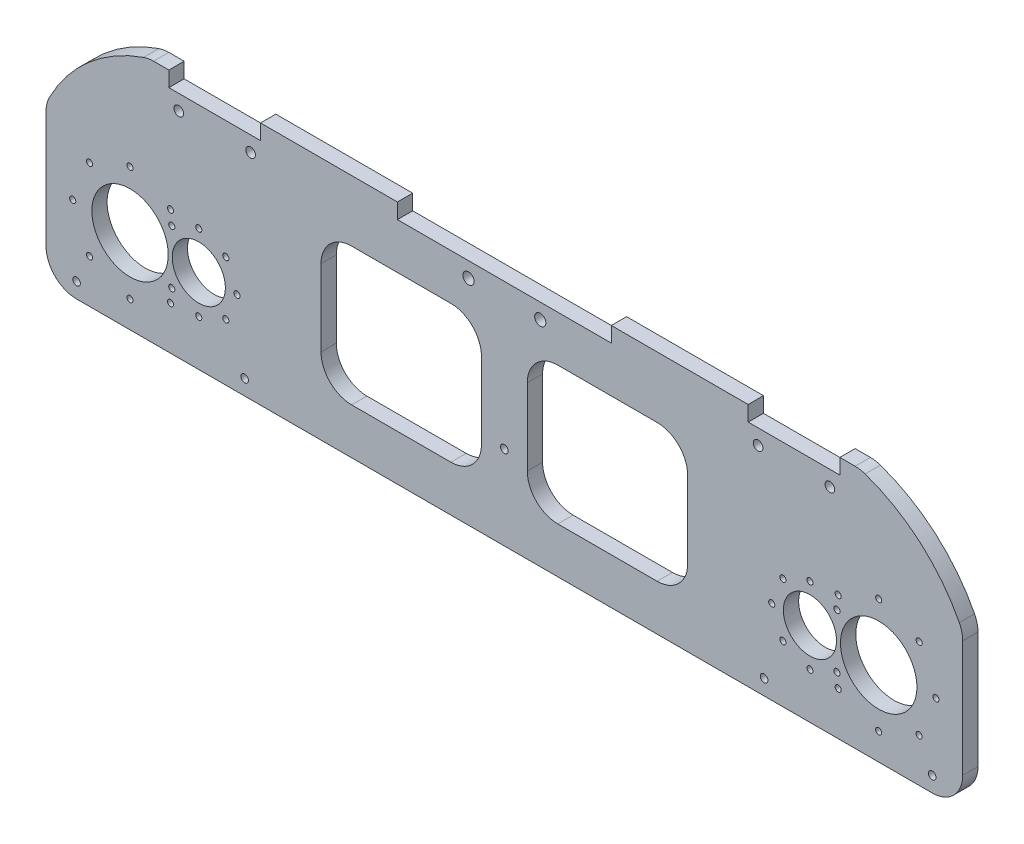
from build123d import *

# Parameters (mm, degrees)
SKETCH1_R           = 3.175
BOSS_EXTRUDE1_DEPTH = 3.175
SKETCH2_R           = 11.049
SKETCH2_R_2         = 15.875
SKETCH2_R_3         = 1.27
CUT_EXTRUDE1_DEPTH  = 202.930998425
SKETCH3_W           = 38.1
SKETCH3_H           = 6.35
SKETCH3_W_2         = 88.9
CUT_EXTRUDE4_DEPTH  = 202.930998425
CUT_EXTRUDE5_DEPTH  = 202.930998425
SKETCH5_R           = 2.003539073
SKETCH5_R_2         = 2.332520908
CUT_EXTRUDE6_DEPTH  = 202.930998425
SKETCH6_R           = 1.5875
CUT_EXTRUDE7_DEPTH  = 202.930998425
SKETCH7_R           = 1.5875
CUT_EXTRUDE8_DEPTH  = 202.930998425


with BuildPart() as part:
    # Sketch1 → Boss-Extrude1 (new, symmetric)
    with BuildSketch(Plane.XY):
        with BuildLine():
            Line((-145.783553311, 66.675), (145.783553311, 66.675))
            ThreePointArc((145.783553311, 66.675), (147.900219978, 66.497368874), (149.957676269, 65.969444444))
            ThreePointArc((149.957676269, 65.969444444), (172.789871953, 52.74760778), (189.088888889, 31.999880883))
            ThreePointArc((189.088888889, 31.999880883), (190.142181511, 29.17513943), (190.5, 26.181720723))
            Line((190.5, 26.181720723), (190.5, -22.225))
            ThreePointArc((190.5, -22.225), (186.780256121, -31.205256121), (177.8, -34.925))
            Line((177.8, -34.925), (-177.8, -34.925))
            ThreePointArc((-177.8, -34.925), (-186.780256121, -31.205256121), (-190.5, -22.225))
            Line((-190.5, -22.225), (-190.5, 26.181720723))
            ThreePointArc((-190.5, 26.181720723), (-190.142181511, 29.17513943), (-189.088888889, 31.999880883))
            ThreePointArc((-189.088888889, 31.999880883), (-172.789871953, 52.74760778), (-149.957676269, 65.969444444))
            ThreePointArc((-149.957676269, 65.969444444), (-147.900219978, 66.497368874), (-145.783553311, 66.675))
        make_face()
        with Locations((-127, 0)):
            Circle(SKETCH1_R, mode=Mode.SUBTRACT)
        with Locations((127, 0)):
            Circle(SKETCH1_R, mode=Mode.SUBTRACT)
    extrude(amount=BOSS_EXTRUDE1_DEPTH, both=True)

    # Sketch2 → Cut-Extrude1 (cut, through all)
    with BuildSketch(Plane.XY.offset(3.175)):
        with Locations((-127, 0)):
            Circle(SKETCH2_R)
        with Locations((-155.575, 0)):
            Circle(SKETCH2_R_2)
        with Locations((-155.575, 23.8125)):
            Circle(SKETCH2_R_3)
        with Locations((-138.737019773, 16.837980227)):
            Circle(SKETCH2_R_3)
        with Locations((-138.737019773, -16.837980227)):
            Circle(SKETCH2_R_3)
        with Locations((-155.575, -23.8125)):
            Circle(SKETCH2_R_3)
        with Locations((-172.412980227, -16.837980227)):
            Circle(SKETCH2_R_3)
        with Locations((-179.3875, 0)):
            Circle(SKETCH2_R_3)
        with Locations((-172.412980227, 16.837980227)):
            Circle(SKETCH2_R_3)
        with Locations((-127, 15.875)):
            Circle(SKETCH2_R_3)
        with Locations((-115.774679849, 11.225320151)):
            Circle(SKETCH2_R_3)
        with Locations((-111.125, 0)):
            Circle(SKETCH2_R_3)
        with Locations((-115.774679849, -11.225320151)):
            Circle(SKETCH2_R_3)
        with Locations((-127, -15.875)):
            Circle(SKETCH2_R_3)
        with Locations((-138.225320151, -11.225320151)):
            Circle(SKETCH2_R_3)
        with Locations(Location((138.225320151, 11.225320151, 0), (0, 0, 180))):
            Circle(SKETCH2_R_3)
        with Locations((-138.225320151, 11.225320151)):
            Circle(SKETCH2_R_3)
        with Locations(Location((138.225320151, -11.225320151, 0), (0, 0, 180))):
            Circle(SKETCH2_R_3)
        with Locations(Location((127, -15.875, 0), (0, 0, 180))):
            Circle(SKETCH2_R_3)
        with Locations(Location((115.774679849, -11.225320151, 0), (0, 0, 180))):
            Circle(SKETCH2_R_3)
        with Locations(Location((111.125, 0, 0), (0, 0, 180))):
            Circle(SKETCH2_R_3)
        with Locations(Location((115.774679849, 11.225320151, 0), (0, 0, 180))):
            Circle(SKETCH2_R_3)
        with Locations(Location((127, 15.875, 0), (0, 0, 180))):
            Circle(SKETCH2_R_3)
        with Locations(Location((172.412980227, 16.837980227, 0), (0, 0, 180))):
            Circle(SKETCH2_R_3)
        with Locations(Location((179.3875, 0, 0), (0, 0, 180))):
            Circle(SKETCH2_R_3)
        with Locations(Location((172.412980227, -16.837980227, 0), (0, 0, 180))):
            Circle(SKETCH2_R_3)
        with Locations(Location((155.575, -23.8125, 0), (0, 0, 180))):
            Circle(SKETCH2_R_3)
        with Locations(Location((138.737019773, -16.837980227, 0), (0, 0, 180))):
            Circle(SKETCH2_R_3)
        with Locations(Location((138.737019773, 16.837980227, 0), (0, 0, 180))):
            Circle(SKETCH2_R_3)
        with Locations(Location((155.575, 23.8125, 0), (0, 0, 180))):
            Circle(SKETCH2_R_3)
        with Locations(Location((155.575, 0, 0), (0, 0, 180))):
            Circle(SKETCH2_R_2)
        with Locations(Location((127, 0, 0), (0, 0, 180))):
            Circle(SKETCH2_R)
    extrude(amount=-CUT_EXTRUDE1_DEPTH, mode=Mode.SUBTRACT)

    # Sketch3 → Cut-Extrude4 (cut, through all)
    with BuildSketch(Plane.XY.offset(3.175)):
        with Locations((-120.383553311, 63.5)):
            Rectangle(SKETCH3_W, SKETCH3_H)
        with Locations((120.383553311, 63.5)):
            Rectangle(SKETCH3_W, SKETCH3_H)
        with Locations((0, 63.5)):
            Rectangle(SKETCH3_W_2, SKETCH3_H)
    extrude(amount=-CUT_EXTRUDE4_DEPTH, mode=Mode.SUBTRACT)

    # Sketch4 → Cut-Extrude5 (cut, through all)
    with BuildSketch(Plane.XY.offset(3.175)):
        with BuildLine():
            Line((-63.5, 41.275), (-22.225, 41.275))
            ThreePointArc((-22.225, 41.275), (-13.244743879, 37.555256121), (-9.525, 28.575))
            Line((-9.525, 28.575), (-9.525, -3.175))
            ThreePointArc((-9.525, -3.175), (-13.244743879, -12.155256121), (-22.225, -15.875))
            Line((-22.225, -15.875), (-63.5, -15.875))
            ThreePointArc((-63.5, -15.875), (-72.480256121, -12.155256121), (-76.2, -3.175))
            Line((-76.2, -3.175), (-76.2, 28.575))
            ThreePointArc((-76.2, 28.575), (-72.480256121, 37.555256121), (-63.5, 41.275))
        make_face()
        with BuildLine():
            Line((76.2, 28.575), (76.2, -3.175))
            ThreePointArc((76.2, -3.175), (72.480256121, -12.155256121), (63.5, -15.875))
            Line((63.5, -15.875), (22.225, -15.875))
            ThreePointArc((22.225, -15.875), (13.244743879, -12.155256121), (9.525, -3.175))
            Line((9.525, -3.175), (9.525, 28.575))
            ThreePointArc((9.525, 28.575), (13.244743879, 37.555256121), (22.225, 41.275))
            Line((22.225, 41.275), (63.5, 41.275))
            ThreePointArc((63.5, 41.275), (72.480256121, 37.555256121), (76.2, 28.575))
        make_face()
    extrude(amount=-CUT_EXTRUDE5_DEPTH, mode=Mode.SUBTRACT)

    # Sketch5 → Cut-Extrude6 (cut, through all)
    with BuildSketch(Plane.XY.offset(3.175)):
        with Locations((-135.306053311, 53.975)):
            Circle(SKETCH5_R)
        with Locations(Location((-105.461053311, 53.975, 0), (0, 0, 180))):
            Circle(SKETCH5_R)
        with Locations((105.461053311, 53.975)):
            Circle(SKETCH5_R)
        with Locations(Location((135.306053311, 53.975, 0), (0, 0, 180))):
            Circle(SKETCH5_R)
        with Locations((-14.9225, 53.975)):
            Circle(SKETCH5_R_2)
        with Locations(Location((14.9225, 53.975, 0), (0, 0, 180))):
            Circle(SKETCH5_R_2)
    extrude(amount=-CUT_EXTRUDE6_DEPTH, mode=Mode.SUBTRACT)

    # Sketch6 → Cut-Extrude7 (cut, through all)
    with BuildSketch(Plane.XY.offset(3.175)):
        with Locations((-177.8, -28.575)):
            Circle(SKETCH6_R)
        with Locations((-107.95, -28.575)):
            Circle(SKETCH6_R)
        with Locations(Location((107.95, -28.575, 0), (0, 0, 180))):
            Circle(SKETCH6_R)
        with Locations(Location((177.8, -28.575, 0), (0, 0, 180))):
            Circle(SKETCH6_R)
    extrude(amount=-CUT_EXTRUDE7_DEPTH, mode=Mode.SUBTRACT)

    # Sketch7 → Cut-Extrude8 (cut, through all)
    with BuildSketch(Plane.XY.offset(3.175)):
        Circle(SKETCH7_R)
    extrude(amount=-CUT_EXTRUDE8_DEPTH, mode=Mode.SUBTRACT)


solid = part.part
